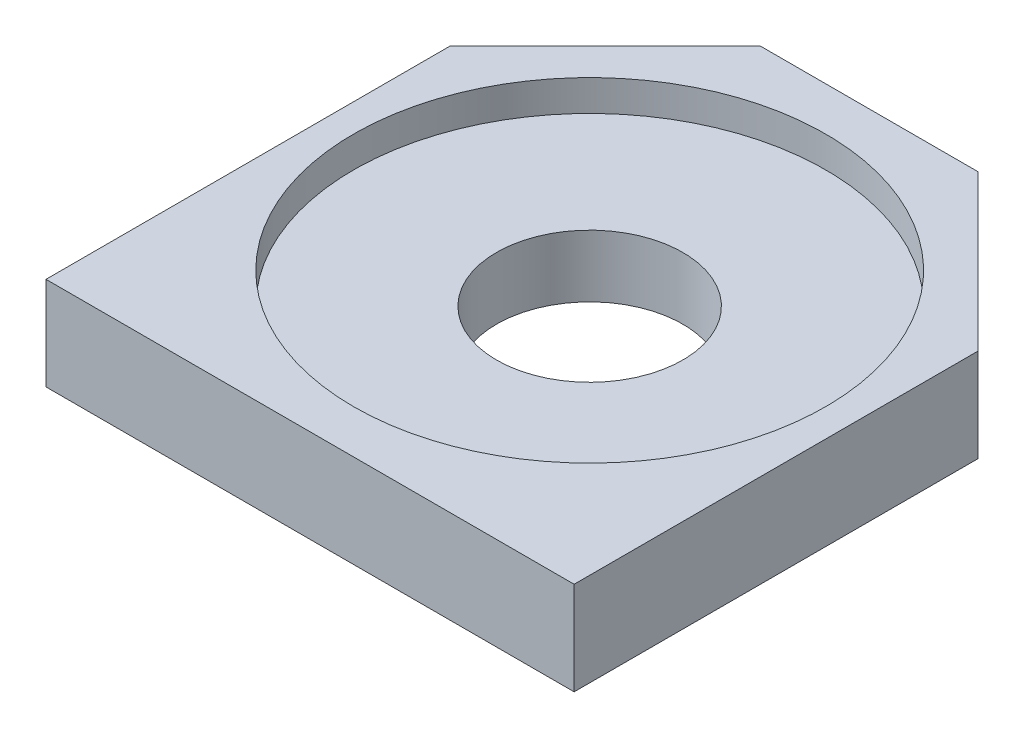
from build123d import *

# Parameters (mm, degrees)
SKETCH_1_W          = 170
SKETCH_1_H          = 180
EXTRUDE_1_DEPTH     = 30
CHAMFER_1_SIZE      = 50
SKETCH_3_R          = 76
CUT_EXTRUDE_1_DEPTH = 10
SKETCH_4_R          = 30
CUT_EXTRUDE_2_DEPTH = 126.39936204
SKETCH_5_W          = 40
SKETCH_5_H          = 15
CUT_EXTRUDE_3_DEPTH = 10


with BuildPart() as part:
    # 草图1 → 凸台-拉伸1 (new body)
    with BuildSketch(Plane(origin=(0, 0, 0), x_dir=(1, 0, 0), z_dir=(0, 1, 0))):
        Rectangle(SKETCH_1_W, SKETCH_1_H)
    extrude(amount=EXTRUDE_1_DEPTH)

    # 倒角1
    chamfer_1_edges = [part.edges().sort_by_distance(p)[0] for p in [
        (-85, 15, -90),
        (85, 15, -90),
    ]]
    chamfer(chamfer_1_edges, length=CHAMFER_1_SIZE)

    # 草图3 → 切除-拉伸1 (cut)
    with BuildSketch(Plane(origin=(0, 30, 0), x_dir=(1, 0, 0), z_dir=(0, 1, 0))):
        with Locations(Location((0, 0, 0), (0, 0, 270))):
            Circle(SKETCH_3_R)
    extrude(amount=-CUT_EXTRUDE_1_DEPTH, mode=Mode.SUBTRACT)

    # 草图4 → 切除-拉伸2 (cut, through all)
    with BuildSketch(Plane(origin=(0, 20, 0), x_dir=(1, 0, 0), z_dir=(0, 1, 0))):
        with Locations(Location((0, 0, 0), (0, 0, 270))):
            Circle(SKETCH_4_R)
    extrude(amount=-CUT_EXTRUDE_2_DEPTH, mode=Mode.SUBTRACT)

    # 草图5 → 切除-拉伸3 (cut)
    with BuildSketch(Plane(origin=(0, 0, -90), x_dir=(-1, 0, 0), z_dir=(0, 0, -1))):
        with Locations((0, 12.5)):
            Rectangle(SKETCH_5_W, SKETCH_5_H)
    extrude(amount=-CUT_EXTRUDE_3_DEPTH, mode=Mode.SUBTRACT)


solid = part.part
